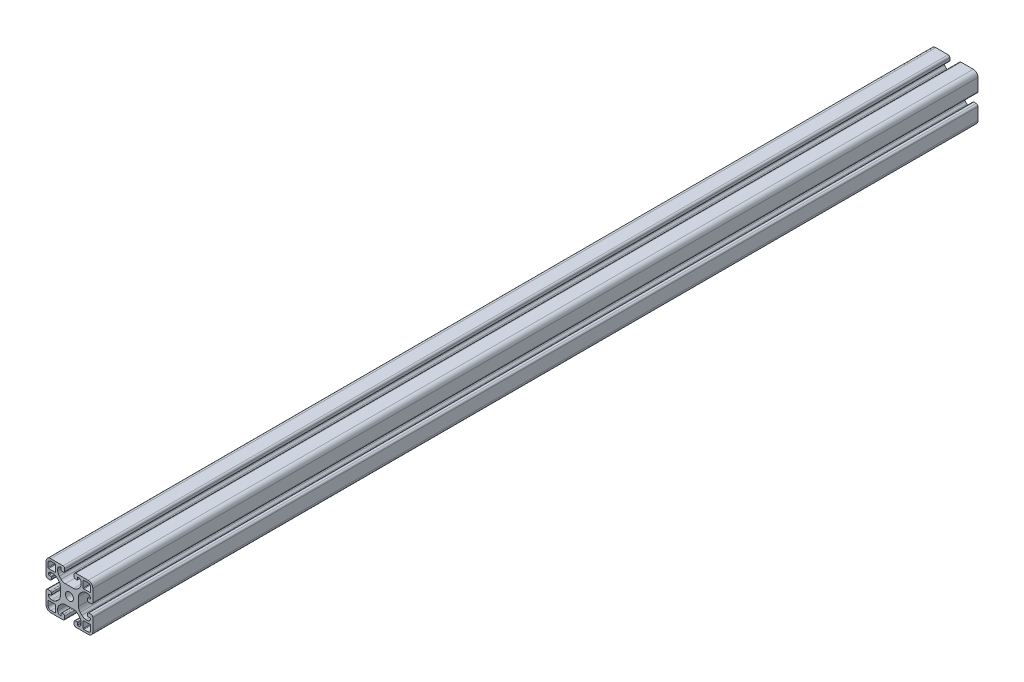
from build123d import *

# Parameters (mm, degrees)
ESQUISSE1_R        = 3.4
BOSS_EXTRU_1_DEPTH = 756


with BuildPart() as part:
    # Esquisse1 → Boss.-Extru.1 (new body)
    with BuildSketch(Plane(origin=(0, 0, -30), x_dir=(-1, 0, 0), z_dir=(0, 0, -1))):
        with BuildLine():
            Line((-4.5, 15), (-4.5, 13.5))
            ThreePointArc((-4.5, 13.5), (-4.353553391, 13.146446609), (-4, 13))
            Line((-4, 13), (-2.5, 13))
            ThreePointArc((-2.5, 13), (-2.146446609, 12.853553391), (-2, 12.5))
            ThreePointArc((-2, 12.5), (-2.732233047, 10.732233047), (-4.5, 10))
            Line((-4.5, 10), (-5.807611845, 10))
            ThreePointArc((-5.807611845, 10), (-7.721029006, 10.380602337), (-9.343145751, 11.464466094))
            Line((-9.343145751, 11.464466094), (-10.785533906, 12.906854249))
            ThreePointArc((-10.785533906, 12.906854249), (-11.869397663, 14.528970994), (-12.25, 16.442388155))
            Line((-12.25, 16.442388155), (-12.25, 23.557611845))
            ThreePointArc((-12.25, 23.557611845), (-11.869397663, 25.471029006), (-10.785533906, 27.093145751))
            Line((-10.785533906, 27.093145751), (-9.343145751, 28.535533906))
            ThreePointArc((-9.343145751, 28.535533906), (-7.721029006, 29.619397663), (-5.807611845, 30))
            Line((-5.807611845, 30), (-4.5, 30))
            ThreePointArc((-4.5, 30), (-2.732233047, 29.267766953), (-2, 27.5))
            ThreePointArc((-2, 27.5), (-2.146446609, 27.146446609), (-2.5, 27))
            Line((-2.5, 27), (-4, 27))
            ThreePointArc((-4, 27), (-4.353553391, 26.853553391), (-4.5, 26.5))
            Line((-4.5, 26.5), (-4.5, 25))
            ThreePointArc((-4.5, 25), (-4.207106781, 24.292893219), (-3.5, 24))
            Line((-3.5, 24), (-1.5, 24))
            ThreePointArc((-1.5, 24), (-0.439339828, 24.439339828), (0, 25.5))
            Line((0, 25.5), (0, 36))
            ThreePointArc((0, 36), (-1.171572875, 38.828427125), (-4, 40))
            Line((-4, 40), (-14.5, 40))
            ThreePointArc((-14.5, 40), (-15.560660172, 39.560660172), (-16, 38.5))
            Line((-16, 38.5), (-16, 36.5))
            ThreePointArc((-16, 36.5), (-15.707106781, 35.792893219), (-15, 35.5))
            Line((-15, 35.5), (-13.5, 35.5))
            ThreePointArc((-13.5, 35.5), (-13.146446609, 35.646446609), (-13, 36))
            Line((-13, 36), (-13, 37.5))
            ThreePointArc((-13, 37.5), (-12.853553391, 37.853553391), (-12.5, 38))
            ThreePointArc((-12.5, 38), (-10.732233047, 37.267766953), (-10, 35.5))
            Line((-10, 35.5), (-10, 34.192388155))
            ThreePointArc((-10, 34.192388155), (-10.380602337, 32.278970994), (-11.464466094, 30.656854249))
            Line((-11.464466094, 30.656854249), (-12.906854249, 29.214466094))
            ThreePointArc((-12.906854249, 29.214466094), (-14.528970994, 28.130602337), (-16.442388155, 27.75))
            Line((-16.442388155, 27.75), (-23.557611845, 27.75))
            ThreePointArc((-23.557611845, 27.75), (-25.471029006, 28.130602337), (-27.093145751, 29.214466094))
            Line((-27.093145751, 29.214466094), (-28.535533906, 30.656854249))
            ThreePointArc((-28.535533906, 30.656854249), (-29.619397663, 32.278970994), (-30, 34.192388155))
            Line((-30, 34.192388155), (-30, 35.5))
            ThreePointArc((-30, 35.5), (-29.267766953, 37.267766953), (-27.5, 38))
            ThreePointArc((-27.5, 38), (-27.146446609, 37.853553391), (-27, 37.5))
            Line((-27, 37.5), (-27, 36))
            ThreePointArc((-27, 36), (-26.853553391, 35.646446609), (-26.5, 35.5))
            Line((-26.5, 35.5), (-25, 35.5))
            ThreePointArc((-25, 35.5), (-24.292893219, 35.792893219), (-24, 36.5))
            Line((-24, 36.5), (-24, 38.5))
            ThreePointArc((-24, 38.5), (-24.439339828, 39.560660172), (-25.5, 40))
            Line((-25.5, 40), (-36, 40))
            ThreePointArc((-36, 40), (-38.828427125, 38.828427125), (-40, 36))
            Line((-40, 36), (-40, 25.5))
            ThreePointArc((-40, 25.5), (-39.560660172, 24.439339828), (-38.5, 24))
            Line((-38.5, 24), (-36.5, 24))
            ThreePointArc((-36.5, 24), (-35.792893219, 24.292893219), (-35.5, 25))
            Line((-35.5, 25), (-35.5, 26.5))
            ThreePointArc((-35.5, 26.5), (-35.646446609, 26.853553391), (-36, 27))
            Line((-36, 27), (-37.5, 27))
            ThreePointArc((-37.5, 27), (-37.853553391, 27.146446609), (-38, 27.5))
            ThreePointArc((-38, 27.5), (-37.267766953, 29.267766953), (-35.5, 30))
            Line((-35.5, 30), (-34.192388155, 30))
            ThreePointArc((-34.192388155, 30), (-32.278970994, 29.619397663), (-30.656854249, 28.535533906))
            Line((-30.656854249, 28.535533906), (-29.214466094, 27.093145751))
            ThreePointArc((-29.214466094, 27.093145751), (-28.130602337, 25.471029006), (-27.75, 23.557611845))
            Line((-27.75, 23.557611845), (-27.75, 16.442388155))
            ThreePointArc((-27.75, 16.442388155), (-28.130602337, 14.528970994), (-29.214466094, 12.906854249))
            Line((-29.214466094, 12.906854249), (-30.656854249, 11.464466094))
            ThreePointArc((-30.656854249, 11.464466094), (-32.278970994, 10.380602337), (-34.192388155, 10))
            Line((-34.192388155, 10), (-35.5, 10))
            ThreePointArc((-35.5, 10), (-37.267766953, 10.732233047), (-38, 12.5))
            ThreePointArc((-38, 12.5), (-37.853553391, 12.853553391), (-37.5, 13))
            Line((-37.5, 13), (-36, 13))
            ThreePointArc((-36, 13), (-35.646446609, 13.146446609), (-35.5, 13.5))
            Line((-35.5, 13.5), (-35.5, 15))
            ThreePointArc((-35.5, 15), (-35.792893219, 15.707106781), (-36.5, 16))
            Line((-36.5, 16), (-38.5, 16))
            ThreePointArc((-38.5, 16), (-39.560660172, 15.560660172), (-40, 14.5))
            Line((-40, 14.5), (-40, 4))
            ThreePointArc((-40, 4), (-38.828427125, 1.171572875), (-36, 0))
            Line((-36, 0), (-25.5, 0))
            ThreePointArc((-25.5, 0), (-24.439339828, 0.439339828), (-24, 1.5))
            Line((-24, 1.5), (-24, 3.5))
            ThreePointArc((-24, 3.5), (-24.292893219, 4.207106781), (-25, 4.5))
            Line((-25, 4.5), (-26.5, 4.5))
            ThreePointArc((-26.5, 4.5), (-26.853553391, 4.353553391), (-27, 4))
            Line((-27, 4), (-27, 2.5))
            ThreePointArc((-27, 2.5), (-27.146446609, 2.146446609), (-27.5, 2))
            ThreePointArc((-27.5, 2), (-29.267766953, 2.732233047), (-30, 4.5))
            Line((-30, 4.5), (-30, 5.807611845))
            ThreePointArc((-30, 5.807611845), (-29.619397663, 7.721029006), (-28.535533906, 9.343145751))
            Line((-28.535533906, 9.343145751), (-27.093145751, 10.785533906))
            ThreePointArc((-27.093145751, 10.785533906), (-25.471029006, 11.869397663), (-23.557611845, 12.25))
            Line((-23.557611845, 12.25), (-16.442388155, 12.25))
            ThreePointArc((-16.442388155, 12.25), (-14.528970994, 11.869397663), (-12.906854249, 10.785533906))
            Line((-12.906854249, 10.785533906), (-11.464466094, 9.343145751))
            ThreePointArc((-11.464466094, 9.343145751), (-10.380602337, 7.721029006), (-10, 5.807611845))
            Line((-10, 5.807611845), (-10, 4.5))
            ThreePointArc((-10, 4.5), (-10.732233047, 2.732233047), (-12.5, 2))
            ThreePointArc((-12.5, 2), (-12.853553391, 2.146446609), (-13, 2.5))
            Line((-13, 2.5), (-13, 4))
            ThreePointArc((-13, 4), (-13.146446609, 4.353553391), (-13.5, 4.5))
            Line((-13.5, 4.5), (-15, 4.5))
            ThreePointArc((-15, 4.5), (-15.707106781, 4.207106781), (-16, 3.5))
            Line((-16, 3.5), (-16, 1.5))
            ThreePointArc((-16, 1.5), (-15.560660172, 0.439339828), (-14.5, 0))
            Line((-14.5, 0), (-4, 0))
            ThreePointArc((-4, 0), (-1.171572875, 1.171572875), (0, 4))
            Line((0, 4), (0, 14.5))
            ThreePointArc((0, 14.5), (-0.439339828, 15.560660172), (-1.5, 16))
            Line((-1.5, 16), (-3.5, 16))
            ThreePointArc((-3.5, 16), (-4.207106781, 15.707106781), (-4.5, 15))
        make_face()
        with Locations(Location((-20, 20, 0), (0, 0, 180))):
            Circle(ESQUISSE1_R, mode=Mode.SUBTRACT)
        with BuildLine():
            Line((-4, 1.8), (-7.7, 1.8))
            ThreePointArc((-7.7, 1.8), (-8.053553391, 1.946446609), (-8.2, 2.3))
            Line((-8.2, 2.3), (-8.2, 7.7))
            ThreePointArc((-8.2, 7.7), (-8.053553391, 8.053553391), (-7.7, 8.2))
            Line((-7.7, 8.2), (-2.3, 8.2))
            ThreePointArc((-2.3, 8.2), (-1.946446609, 8.053553391), (-1.8, 7.7))
            Line((-1.8, 7.7), (-1.8, 4))
            ThreePointArc((-1.8, 4), (-2.444365081, 2.444365081), (-4, 1.8))
        make_face(mode=Mode.SUBTRACT)
        with BuildLine():
            Line((-38.2, 4), (-38.2, 7.7))
            ThreePointArc((-38.2, 7.7), (-38.053553391, 8.053553391), (-37.7, 8.2))
            Line((-37.7, 8.2), (-32.3, 8.2))
            ThreePointArc((-32.3, 8.2), (-31.946446609, 8.053553391), (-31.8, 7.7))
            Line((-31.8, 7.7), (-31.8, 2.3))
            ThreePointArc((-31.8, 2.3), (-31.946446609, 1.946446609), (-32.3, 1.8))
            Line((-32.3, 1.8), (-36, 1.8))
            ThreePointArc((-36, 1.8), (-37.555634919, 2.444365081), (-38.2, 4))
        make_face(mode=Mode.SUBTRACT)
        with BuildLine():
            Line((-36, 38.2), (-32.3, 38.2))
            ThreePointArc((-32.3, 38.2), (-31.946446609, 38.053553391), (-31.8, 37.7))
            Line((-31.8, 37.7), (-31.8, 32.3))
            ThreePointArc((-31.8, 32.3), (-31.946446609, 31.946446609), (-32.3, 31.8))
            Line((-32.3, 31.8), (-37.7, 31.8))
            ThreePointArc((-37.7, 31.8), (-38.053553391, 31.946446609), (-38.2, 32.3))
            Line((-38.2, 32.3), (-38.2, 36))
            ThreePointArc((-38.2, 36), (-37.555634919, 37.555634919), (-36, 38.2))
        make_face(mode=Mode.SUBTRACT)
        with BuildLine():
            Line((-1.8, 36), (-1.8, 32.3))
            ThreePointArc((-1.8, 32.3), (-1.946446609, 31.946446609), (-2.3, 31.8))
            Line((-2.3, 31.8), (-7.7, 31.8))
            ThreePointArc((-7.7, 31.8), (-8.053553391, 31.946446609), (-8.2, 32.3))
            Line((-8.2, 32.3), (-8.2, 37.7))
            ThreePointArc((-8.2, 37.7), (-8.053553391, 38.053553391), (-7.7, 38.2))
            Line((-7.7, 38.2), (-4, 38.2))
            ThreePointArc((-4, 38.2), (-2.444365081, 37.555634919), (-1.8, 36))
        make_face(mode=Mode.SUBTRACT)
    extrude(amount=-BOSS_EXTRU_1_DEPTH)


solid = part.part
